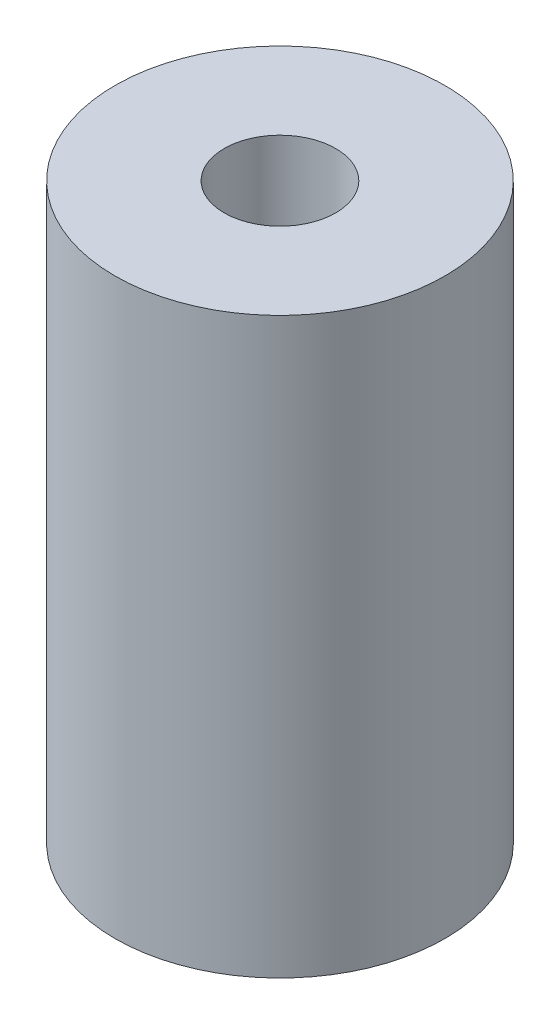
from build123d import *

# Parameters (mm, degrees)
SKETCH2_R           = 65.7225
SKETCH2_R_2         = 22.225
BOSS_EXTRUDE1_DEPTH = 228.6


with BuildPart() as part:
    # Sketch2 → Boss-Extrude1 (new body)
    with BuildSketch(Plane(origin=(0, 0, 0), x_dir=(1, 0, 0), z_dir=(0, 1, 0))):
        with Locations(Location((0, 0, 0), (0, 0, 270))):
            Circle(SKETCH2_R)
        with Locations(Location((0, 0, 0), (0, 0, 270))):
            Circle(SKETCH2_R_2, mode=Mode.SUBTRACT)
    extrude(amount=BOSS_EXTRUDE1_DEPTH)


solid = part.part
